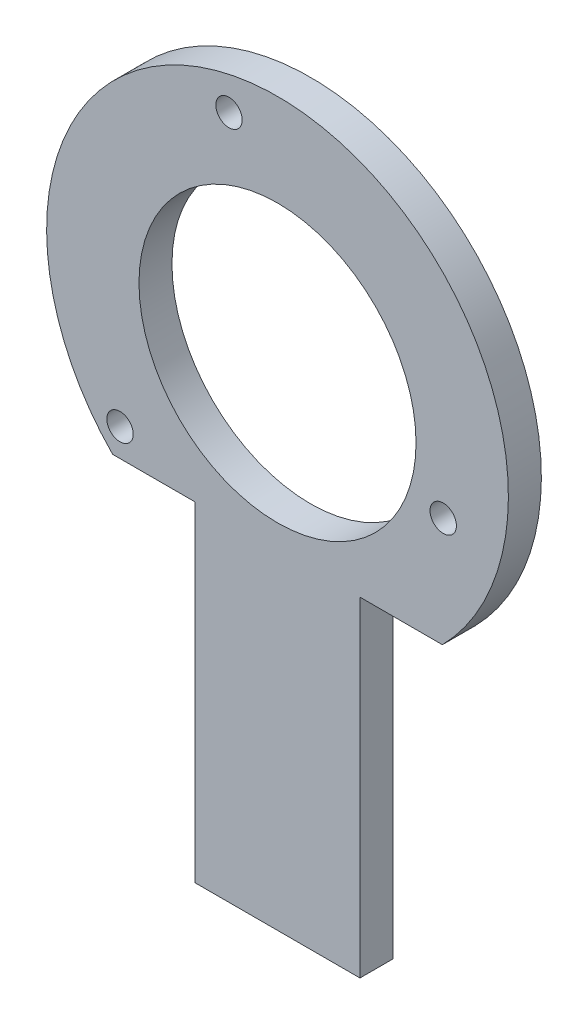
from build123d import *

# Parameters (mm, degrees)
SKETCH1_R           = 35.56
BOSS_EXTRUDE1_DEPTH = 5.08
CUT_EXTRUDE1_DEPTH  = 51.545361805
SKETCH7_R           = 2.032
CUT_EXTRUDE2_DEPTH  = 51.545361805
SKETCH8_R           = 21.336
CUT_EXTRUDE3_DEPTH  = 51.545361805
SKETCH9_W           = 25.4
SKETCH9_H           = 5.08
BOSS_EXTRUDE2_DEPTH = 50.8


with BuildPart() as part:
    # Sketch1 → Boss-Extrude1 (new body)
    with BuildSketch(Plane.XY):
        Circle(SKETCH1_R)
    extrude(amount=BOSS_EXTRUDE1_DEPTH)

    # Sketch2 → Cut-Extrude1 (cut, through all)
    with BuildSketch(Plane.XY.offset(5.08)):
        Polygon((0, -35.56), (-36.256055522, -35.56), (-36.256055522, -24.892), (33.75035888, -24.892), (33.75035888, -35.56), align=None)
    extrude(amount=-CUT_EXTRUDE1_DEPTH, mode=Mode.SUBTRACT)

    # Sketch7 → Cut-Extrude2 (cut, through all)
    with BuildSketch(Plane.XY.offset(5.08)):
        with Locations((-24.261099887, -20.626476503)):
            Circle(SKETCH7_R)
        with Locations((-7.471969114, 29.665523497)):
            Circle(SKETCH7_R)
        with Locations((25.522900113, -7.952823738)):
            Circle(SKETCH7_R)
    extrude(amount=-CUT_EXTRUDE2_DEPTH, mode=Mode.SUBTRACT)

    # Sketch8 → Cut-Extrude3 (cut, through all)
    with BuildSketch(Plane(origin=(0, 0, 0), x_dir=(-1, 0, 0), z_dir=(0, 0, -1))):
        Circle(SKETCH8_R)
    extrude(amount=-CUT_EXTRUDE3_DEPTH, mode=Mode.SUBTRACT)

    # Sketch9 → Boss-Extrude2 (add)
    with BuildSketch(Plane.XZ.offset(24.892)):
        with Locations((0, 2.54)):
            Rectangle(SKETCH9_W, SKETCH9_H)
    extrude(amount=BOSS_EXTRUDE2_DEPTH)


solid = part.part
